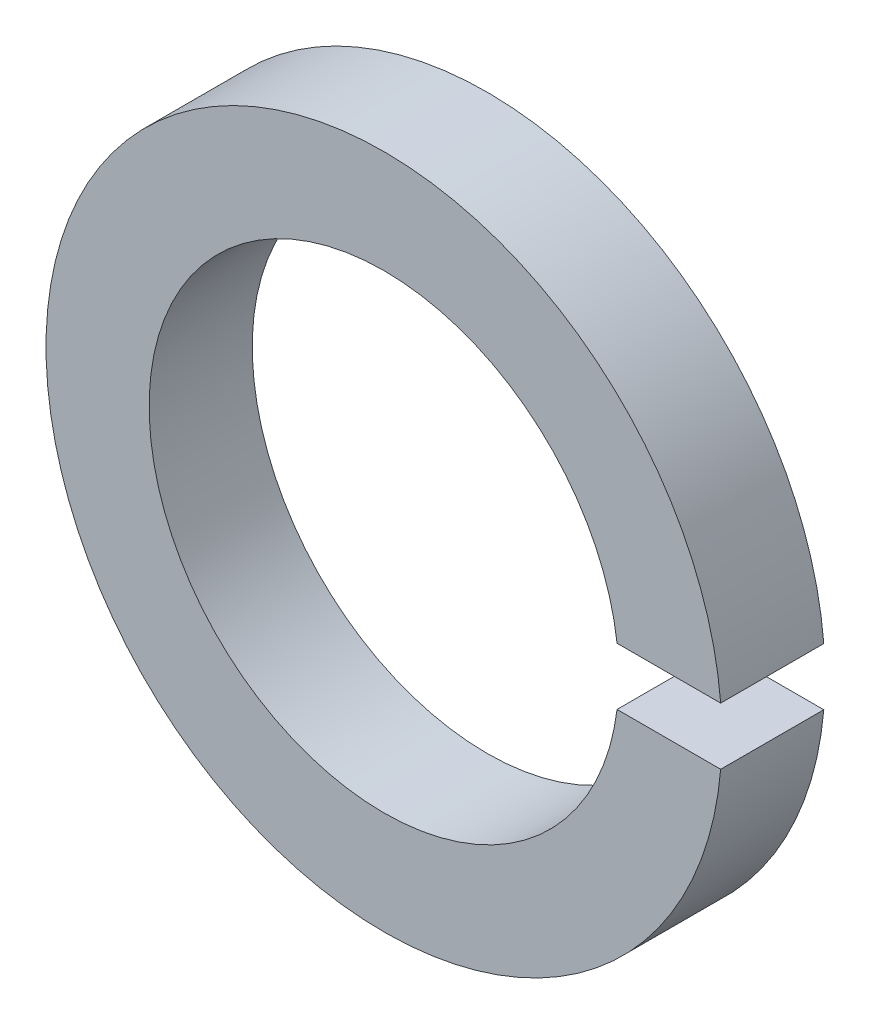
from build123d import *

# Parameters (mm, degrees)
SKETCH_1_R          = 14.75
SKETCH_1_R_2        = 10.25
EXTRUDE_1_DEPTH     = 4.5
SKETCH_2_W          = 14.75
SKETCH_2_H          = 2.5
CUT_EXTRUDE_1_DEPTH = 22.339517333


with BuildPart() as part:
    # Эскиз1 → Вытянуть1 (new body)
    with BuildSketch(Plane.XY):
        Circle(SKETCH_1_R)
        Circle(SKETCH_1_R_2, mode=Mode.SUBTRACT)
    extrude(amount=EXTRUDE_1_DEPTH)

    # Эскиз2 → Вырез-Вытянуть1 (cut, through all)
    with BuildSketch(Plane.XY.offset(4.5)):
        with Locations((7.375, 0)):
            Rectangle(SKETCH_2_W, SKETCH_2_H)
    extrude(amount=-CUT_EXTRUDE_1_DEPTH, mode=Mode.SUBTRACT)


solid = part.part
